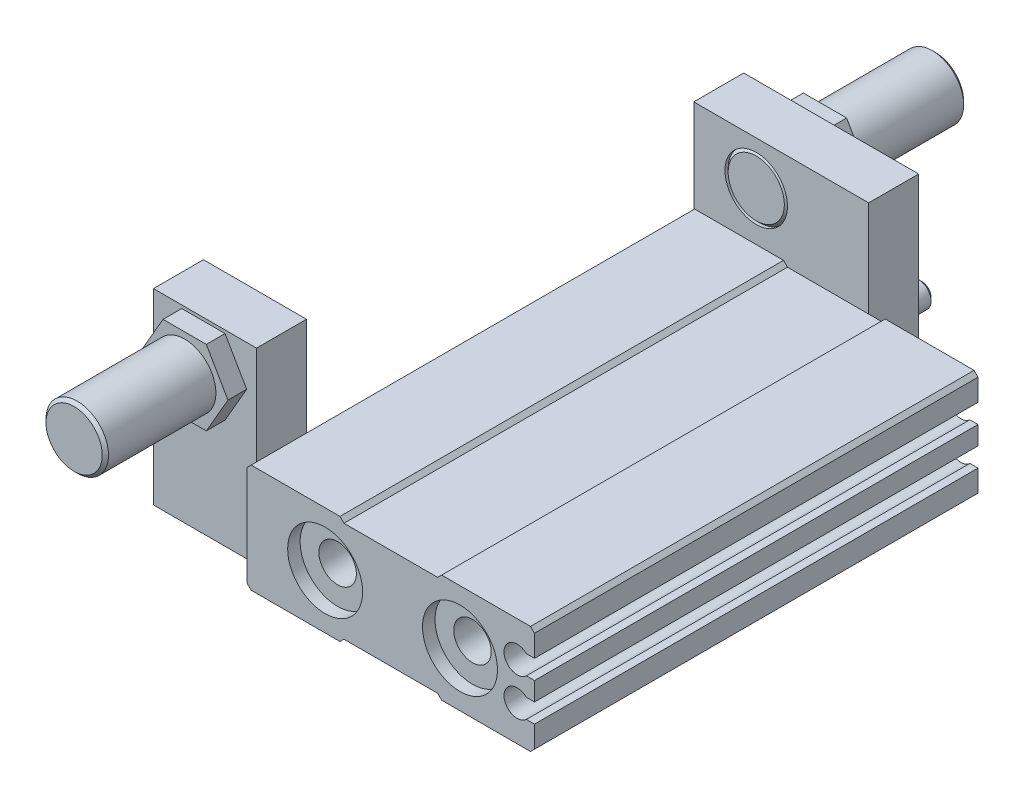
from build123d import *

# Parameters (mm, degrees)
BASE_EXTRUDE_START               = -71
BASE_EXTRUDE_DEPTH               = 71
SKETCH2_R                        = 6
CUT_EXTRUDE1_DEPTH               = 69.7
SKETCH4_R                        = 6
BOSS_EXTRUDE1_DEPTH              = 10
CUT_EXTRUDE3_REACH               = 75.248
SKETCH19_R                       = 3
F_10_32_TAPPED_HOLE1_D           = 4.0386
F_10_32_TAPPED_HOLE1_DEPTH       = 13.6144
F_10_32_TAPPED_HOLE1_CBORE_D     = 4.826
F_10_32_TAPPED_HOLE1_CBORE_DEPTH = 9.652
F_10_32_TAPPED_HOLE1_TIP         = 1.213317848
F_4_40_TAPPED_HOLE1_D            = 2.2606
F_4_40_TAPPED_HOLE1_DEPTH        = 8.8646
F_4_40_TAPPED_HOLE1_CBORE_D      = 2.8448
F_4_40_TAPPED_HOLE1_CBORE_DEPTH  = 5.6896
F_4_40_TAPPED_HOLE1_TIP          = 0.679152758
HOLE1_D                          = 4
HOLE1_DEPTH                      = 3.5
CUT_EXTRUDE4_DEPTH               = 3.5
F_10_32_TAPPED_HOLE2_D           = 4.0386
F_10_32_TAPPED_HOLE2_DEPTH       = 13.6144
F_10_32_TAPPED_HOLE2_CBORE_D     = 4.826
F_10_32_TAPPED_HOLE2_CBORE_DEPTH = 9.652
F_10_32_TAPPED_HOLE2_TIP         = 1.213317848
SKETCH30_W                       = 28
SKETCH30_H                       = 31
BOSS_EXTRUDE2_DEPTH              = 8
BOSS_EXTRUDE3_DEPTH              = 3
SKETCH35_R                       = 2
BOSS_EXTRUDE5_DEPTH              = 3
CHAMFER2_SIZE                    = 0.5
BOSS_EXTRUDE6_DEPTH              = 8
BOSS_EXTRUDE7_DEPTH              = 3
CUT_EXTRUDE7_REACH               = 97.076
SKETCH38_R                       = 5
CUT_EXTRUDE8_REACH               = 112.864
SKETCH46_R                       = 5
CHAMFER3_SIZE                    = 0.5


with BuildPart() as part:
    # Sketch1 → Base-Extrude (new body)
    with BuildSketch(Plane(origin=(0, 0, 53.15), x_dir=(-1, 0, 0), z_dir=(0, 0, 1)).offset(BASE_EXTRUDE_START)):
        with BuildLine():
            Line((22.365, 8.6741), (23, 8.0391))
            Line((23, 8.0391), (23, -8.0391))
            Line((23, -8.0391), (22.365, -8.6741))
            Line((22.365, -8.6741), (8.135, -8.6741))
            Line((8.135, -8.6741), (7.5, -8.0391))
            Line((7.5, -8.0391), (-7.5, -8.0391))
            Line((-7.5, -8.0391), (-8.135, -8.6741))
            Line((-8.135, -8.6741), (-22.365, -8.6741))
            Line((-22.365, -8.6741), (-23, -8.0391))
            Line((-23, -8.0391), (-23, -4.5593))
            Line((-23, -4.5593), (-21.70268423, -4.5593))
            ThreePointArc((-21.70268423, -4.5593), (-18.120014782, -3.0226), (-21.70268423, -1.4859))
            Line((-21.70268423, -1.4859), (-23, -1.4859))
            Line((-23, -1.4859), (-23, 1.4859))
            Line((-23, 1.4859), (-21.70268423, 1.4859))
            ThreePointArc((-21.70268423, 1.4859), (-18.120014782, 3.0226), (-21.70268423, 4.5593))
            Line((-21.70268423, 4.5593), (-23, 4.5593))
            Line((-23, 4.5593), (-23, 8.0391))
            Line((-23, 8.0391), (-22.365, 8.6741))
            Line((-22.365, 8.6741), (-8.135, 8.6741))
            Line((-8.135, 8.6741), (-7.5, 8.0391))
            Line((-7.5, 8.0391), (7.5, 8.0391))
            Line((7.5, 8.0391), (8.135, 8.6741))
            Line((8.135, 8.6741), (22.365, 8.6741))
        make_face()
    extrude(amount=BASE_EXTRUDE_DEPTH)

    # Sketch2 → Cut-Extrude1 (cut)
    with BuildSketch(Plane(origin=(0, 0, 53.15), x_dir=(-1, 0, 0), z_dir=(0, 0, -1))):
        with Locations(Location((-11.0744, 0, 0), (0, 0, 180))):
            Circle(SKETCH2_R)
        with Locations(Location((10.5156, 0, 0), (0, 0, 180))):
            Circle(SKETCH2_R)
    extrude(amount=CUT_EXTRUDE1_DEPTH, mode=Mode.SUBTRACT)

    # Sketch4 → Boss-Extrude1 (add)
    with BuildSketch(Plane.XY.offset(51.15)):
        with Locations((11.0744, 0)):
            Circle(SKETCH4_R)
        with Locations((-10.5156, 0)):
            Circle(SKETCH4_R)
    extrude(amount=-BOSS_EXTRUDE1_DEPTH)

    # Sketch19 → Cut-Extrude3 (cut, up to next)
    with BuildSketch(Plane.XY.offset(51.15), mode=Mode.PRIVATE) as cut_extrude3_sk1:
        with Locations((11.0744, 0)):
            Circle(SKETCH19_R)
    cut_extrude3_tool1 = extrude(cut_extrude3_sk1.sketch, amount=-CUT_EXTRUDE3_REACH, mode=Mode.PRIVATE) & part.part
    # Sketch19 → Cut-Extrude3 (cut, up to next)
    with BuildSketch(Plane.XY.offset(51.15), mode=Mode.PRIVATE) as cut_extrude3_sk2:
        with Locations((-10.5156, 0)):
            Circle(SKETCH19_R)
    cut_extrude3_tool2 = extrude(cut_extrude3_sk2.sketch, amount=-CUT_EXTRUDE3_REACH, mode=Mode.PRIVATE) & part.part
    add(cut_extrude3_tool1.solids().sort_by_distance((11.0744, 0, 51.15))[0], mode=Mode.SUBTRACT)
    add(cut_extrude3_tool2.solids().sort_by_distance((-10.5156, 0, 51.15))[0], mode=Mode.SUBTRACT)

    # #10-32 Tapped Hole1
    with Locations(Plane.XZ.offset(8.0391)):
        with Locations((0, 30.15), (0, 0.15)):
            CounterBoreHole(F_10_32_TAPPED_HOLE1_D / 2, F_10_32_TAPPED_HOLE1_CBORE_D / 2, F_10_32_TAPPED_HOLE1_CBORE_DEPTH, depth=F_10_32_TAPPED_HOLE1_DEPTH)
            with Locations((0, 0, -(F_10_32_TAPPED_HOLE1_DEPTH + F_10_32_TAPPED_HOLE1_TIP / 2))):  # 118° drill point
                Cone(0, F_10_32_TAPPED_HOLE1_D / 2, F_10_32_TAPPED_HOLE1_TIP, mode=Mode.SUBTRACT)

    # #4-40 Tapped Hole1
    with Locations(Plane(origin=(0, 0, -17.85), x_dir=(-1, 0, 0), z_dir=(0, 0, -1))):
        with Locations((20, -4.6741), (20, 4.3259), (-3, -4.6741), (-3, 4.3259)):
            CounterBoreHole(F_4_40_TAPPED_HOLE1_D / 2, F_4_40_TAPPED_HOLE1_CBORE_D / 2, F_4_40_TAPPED_HOLE1_CBORE_DEPTH, depth=F_4_40_TAPPED_HOLE1_DEPTH)
            with Locations((0, 0, -(F_4_40_TAPPED_HOLE1_DEPTH + F_4_40_TAPPED_HOLE1_TIP / 2))):  # 118° drill point
                Cone(0, F_4_40_TAPPED_HOLE1_D / 2, F_4_40_TAPPED_HOLE1_TIP, mode=Mode.SUBTRACT)

    # Hole1
    with Locations(Plane.XZ.offset(8.6741)):
        with Locations((-19, 39.65)):
            Hole(HOLE1_D / 2, depth=HOLE1_DEPTH)

    # Sketch27 → Cut-Extrude4 (cut)
    with BuildSketch(Plane.XZ.offset(8.6741)):
        with BuildLine():
            Line((-21, 5.15), (-21, 4.15))
            ThreePointArc((-21, 4.15), (-19, 2.15), (-17, 4.15))
            Line((-17, 4.15), (-17, 5.15))
            ThreePointArc((-17, 5.15), (-19, 7.15), (-21, 5.15))
        make_face()
    extrude(amount=-CUT_EXTRUDE4_DEPTH, mode=Mode.SUBTRACT)

    # #10-32 Tapped Hole2
    with Locations(Plane.ZY.offset(23)):
        with Locations((34.55, -0.1741), (-14.05, -0.1741)):
            CounterBoreHole(F_10_32_TAPPED_HOLE2_D / 2, F_10_32_TAPPED_HOLE2_CBORE_D / 2, F_10_32_TAPPED_HOLE2_CBORE_DEPTH, depth=F_10_32_TAPPED_HOLE2_DEPTH)
            with Locations((0, 0, -(F_10_32_TAPPED_HOLE2_DEPTH + F_10_32_TAPPED_HOLE2_TIP / 2))):  # 118° drill point
                Cone(0, F_10_32_TAPPED_HOLE2_D / 2, F_10_32_TAPPED_HOLE2_TIP, mode=Mode.SUBTRACT)

    # Sketch30 → Boss-Extrude2 (add)
    with BuildSketch(Plane(origin=(0, 0, -17.85), x_dir=(-1, 0, 0), z_dir=(0, 0, -1))):
        with Locations((8.5, 7.9609)):
            Rectangle(SKETCH30_W, SKETCH30_H)
    extrude(amount=BOSS_EXTRUDE2_DEPTH)

    # Sketch31 → Boss-Extrude3 (add)
    with BuildSketch(Plane(origin=(0, 0, -25.85), x_dir=(-1, 0, 0), z_dir=(0, 0, -1))):
        Polygon((19.42820323, 16.4609), (15.964101615, 22.4609), (9.035898385, 22.4609), (5.57179677, 16.4609), (9.035898385, 10.4609), (15.964101615, 10.4609), align=None)
    extrude(amount=BOSS_EXTRUDE3_DEPTH)

    # Sketch35 → Boss-Extrude5 (add)
    with BuildSketch(Plane(origin=(0, 0, -25.85), x_dir=(-1, 0, 0), z_dir=(0, 0, -1))):
        with Locations((20, 4.3259)):
            Circle(SKETCH35_R)
        with Locations((-3, 4.3259)):
            Circle(SKETCH35_R)
        with Locations((-3, -4.6741)):
            Circle(SKETCH35_R)
        with Locations((20, -4.6741)):
            Circle(SKETCH35_R)
    extrude(amount=BOSS_EXTRUDE5_DEPTH)

    # Chamfer2
    chamfer2_edges = [part.edges().sort_by_distance(p)[0] for p in [
        (-18, 4.3259, -28.85),
        (5, 4.3259, -28.85),
        (5, -4.6741, -28.85),
        (-18, -4.6741, -28.85),
    ]]
    chamfer(chamfer2_edges, length=CHAMFER2_SIZE)

    # Sketch36 → Boss-Extrude6 (add)
    with BuildSketch(Plane.XY.offset(43.15)):
        Polygon((-23.5, 23.3259), (-23.5, 6.6741), (-23, 6.6741), (-23, -6.6741), (-40, -6.6741), (-40, 23.3259), align=None)
    extrude(amount=BOSS_EXTRUDE6_DEPTH)

    # Sketch37 → Boss-Extrude7 (add)
    with BuildSketch(Plane.XY.offset(51.15)):
        Polygon((-28.535898385, 22.8259), (-35.464101615, 22.8259), (-38.92820323, 16.8259), (-35.464101615, 10.8259), (-28.535898385, 10.8259), (-25.07179677, 16.8259), align=None)
    extrude(amount=BOSS_EXTRUDE7_DEPTH)

    # Sketch38 → Cut-Extrude7 (cut, up to next)
    with BuildSketch(Plane.XY.offset(54.15), mode=Mode.PRIVATE) as cut_extrude7_sk1:
        with Locations((-32, 16.8259)):
            Circle(SKETCH38_R)
    cut_extrude7_tool1 = extrude(cut_extrude7_sk1.sketch, amount=-CUT_EXTRUDE7_REACH, mode=Mode.PRIVATE) & part.part
    add(cut_extrude7_tool1.solids().sort_by_distance((-32, 16.8259, 54.15))[0], mode=Mode.SUBTRACT)

    # Sketch44 → Boss-Revolve1 (revolve)
    with BuildSketch(Plane(origin=(0, 16.8259, 0), x_dir=(-1, 0, 0), z_dir=(0, 1, 0)), mode=Mode.PRIVATE) as boss_revolve1_sk:
        Polygon((32, 71.85), (37, 71.85), (37, 43.65), (36.5, 43.15), (32, 43.15), align=None)
    revolve(boss_revolve1_sk.sketch.rotate(Axis((-32, 16.8259, 54.15), (0, 0, -1)), 180), axis=Axis((-32, 16.8259, 54.15), (0, 0, -1)))

    # Sketch46 → Cut-Extrude8 (cut, up to next)
    with BuildSketch(Plane(origin=(0, 0, -28.85), x_dir=(-1, 0, 0), z_dir=(0, 0, -1)), mode=Mode.PRIVATE) as cut_extrude8_sk1:
        with Locations((12.5, 16.4609)):
            Circle(SKETCH46_R)
    cut_extrude8_tool1 = extrude(cut_extrude8_sk1.sketch, amount=-CUT_EXTRUDE8_REACH, mode=Mode.PRIVATE) & part.part
    add(cut_extrude8_tool1.solids().sort_by_distance((-12.5, 16.4609, -28.85))[0], mode=Mode.SUBTRACT)

    # Sketch47 → Boss-Revolve2 (revolve)
    with BuildSketch(Plane(origin=(0, 16.4609, 0), x_dir=(-1, 0, 0), z_dir=(0, 1, 0))):
        Polygon((17, -17.85), (12.5, -17.85), (12.5, -46.55), (17.5, -46.55), (17.5, -18.35), align=None)
    revolve(axis=Axis((-12.5, 16.4609, -17.85), (0, 0, -1)))

    # Chamfer3
    chamfer3_edges = [part.edges().sort_by_distance(p)[0] for p in [
        (-37, 16.8259, 71.85),
        (-7.5, 16.4609, -46.55),
    ]]
    chamfer(chamfer3_edges, length=CHAMFER3_SIZE)


solid = part.part
